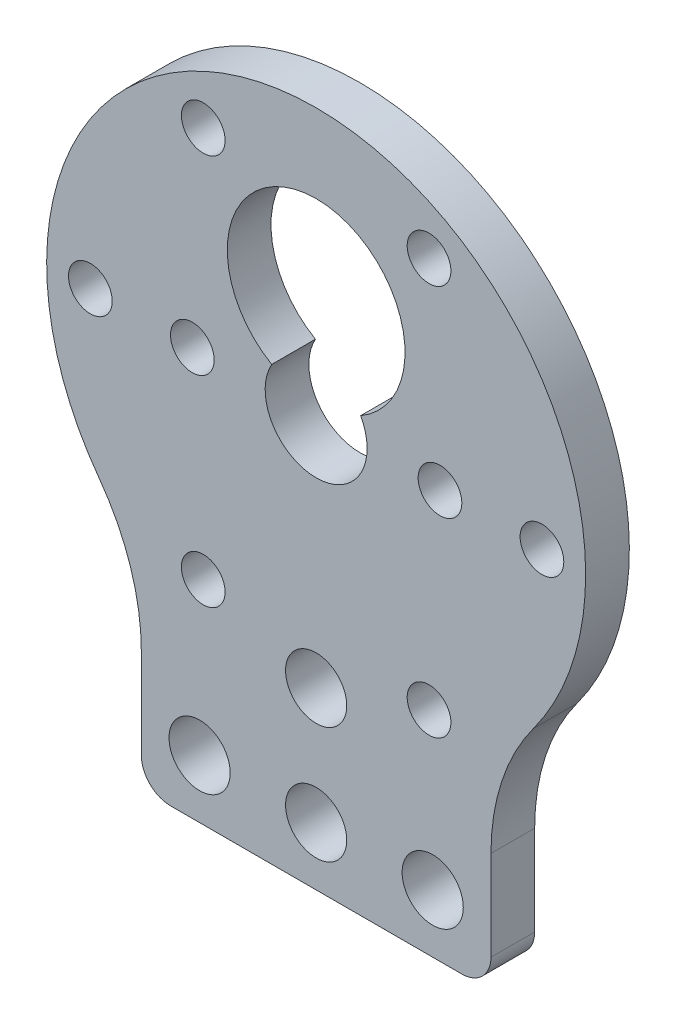
from build123d import *

# Parameters (mm, degrees)
BOSS_EXTRUDE1_DEPTH        = 3
F_3_0_3_DIAMETER_HOLE2_D   = 3
CIRPATTERN1_COUNT          = 6
F_4_2_4_2_DIAMETER_HOLE1_D = 4.2
F_3_0_3_DIAMETER_HOLE1_D   = 3
FILLET1_R                  = 15
FILLET2_R                  = 2


with BuildPart() as part:
    # Sketch2 → Boss-Extrude1 (new body)
    with BuildSketch(Plane.XY):
        with BuildLine():
            Line((0, -28), (12, -28))
            Line((12, -28), (12, -14.08012784))
            ThreePointArc((12, -14.08012784), (0, 18.5), (-12, -14.08012784))
            Line((-12, -14.08012784), (-12, -28))
            Line((-12, -28), (0, -28))
        make_face()
        with BuildLine():
            ThreePointArc((-3.049823013, 1.717142857), (0, -3.5), (3.049823013, 1.717142857))
            ThreePointArc((3.049823013, 1.717142857), (0, 13.1), (-3.049823013, 1.717142857))
        make_face(mode=Mode.SUBTRACT)
    extrude(amount=BOSS_EXTRUDE1_DEPTH)

    # Ø3.0 (3) Diameter Hole2 (through all)
    with Locations(Plane.XY.offset(3)):
        with Locations((15.5, 0)):
            f_3_0_3_diameter_hole2 = Hole(F_3_0_3_DIAMETER_HOLE2_D / 2)

    # CirPattern1: Ø3.0 (3) Diameter Hole2 ×6 about axis
    cirpattern1_axis = Axis((0, 0, -0.15), (0, 0, 1))
    for i in range(1, CIRPATTERN1_COUNT):
        add(f_3_0_3_diameter_hole2.rotate(cirpattern1_axis, i * 360 / CIRPATTERN1_COUNT), mode=Mode.SUBTRACT)

    # Ø4.2 (4.2) Diameter Hole1 (through all)
    with Locations(Plane.XY.offset(3)):
        with Locations((0, -16), (0, -24), (8, -24), (-8, -24)):
            Hole(F_4_2_4_2_DIAMETER_HOLE1_D / 2)

    # Ø3.0 (3) Diameter Hole1 (through all)
    with Locations(Plane.XY.offset(3)):
        with Locations((8.5, 0), (-8.5, 0)):
            Hole(F_3_0_3_DIAMETER_HOLE1_D / 2)

    # Fillet1
    fillet1_edges = [part.edges().sort_by_distance(p)[0] for p in [
        (12, -14.08012784, 1.5),
        (-12, -14.08012784, 1.5),
    ]]
    fillet(fillet1_edges, radius=FILLET1_R)

    # Fillet2
    fillet2_edges = [part.edges().sort_by_distance(p)[0] for p in [
        (12, -28, 1.5),
        (-12, -28, 1.5),
    ]]
    fillet(fillet2_edges, radius=FILLET2_R)


solid = part.part
